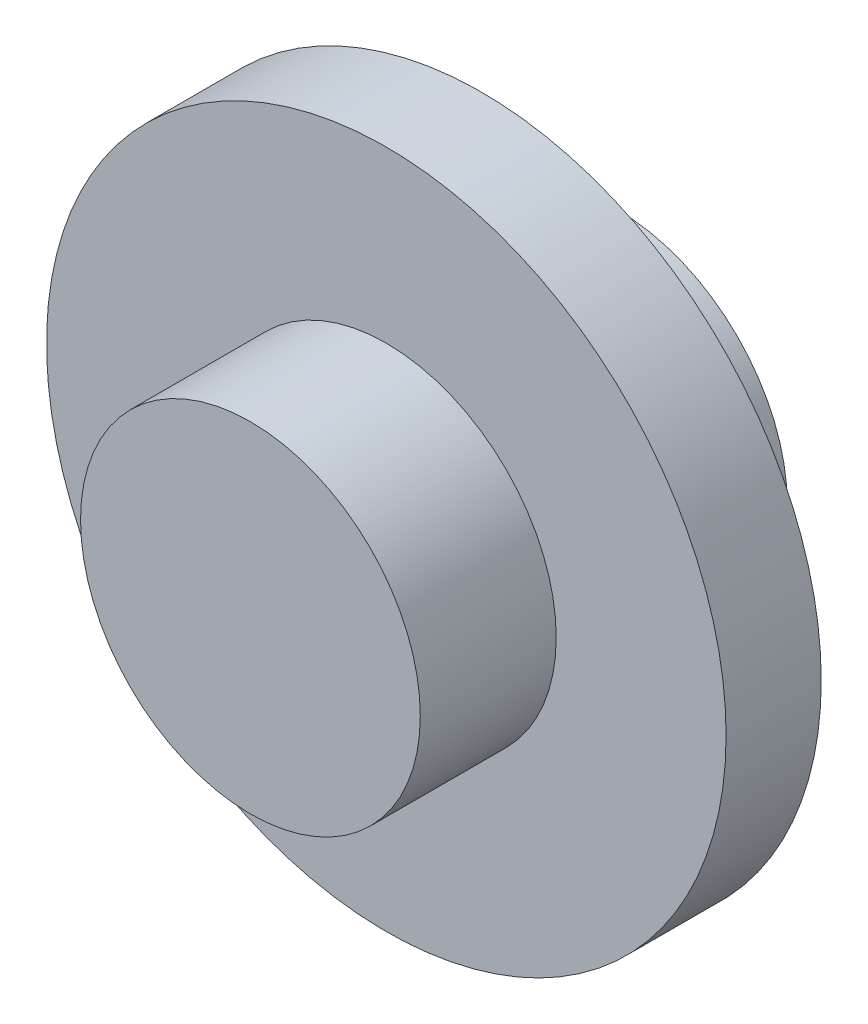
from build123d import *

# Parameters (mm, degrees)
SKETCH_1_R      = 12.5
EXTRUDE_1_DEPTH = 10
SKETCH_2_R      = 25
EXTRUDE_2_DEPTH = 7
SKETCH_3_R      = 12.5
EXTRUDE_3_DEPTH = 10


with BuildPart() as part:
    # 草图1 → 凸台-拉伸1 (new body)
    with BuildSketch(Plane.XY):
        Circle(SKETCH_1_R)
    extrude(amount=EXTRUDE_1_DEPTH)

    # 草图2 → 凸台-拉伸2 (add)
    with BuildSketch(Plane.XY.offset(10)):
        Circle(SKETCH_2_R)
    extrude(amount=EXTRUDE_2_DEPTH)

    # 草图3 → 凸台-拉伸3 (add)
    with BuildSketch(Plane.XY.offset(17)):
        Circle(SKETCH_3_R)
    extrude(amount=EXTRUDE_3_DEPTH)


solid = part.part
